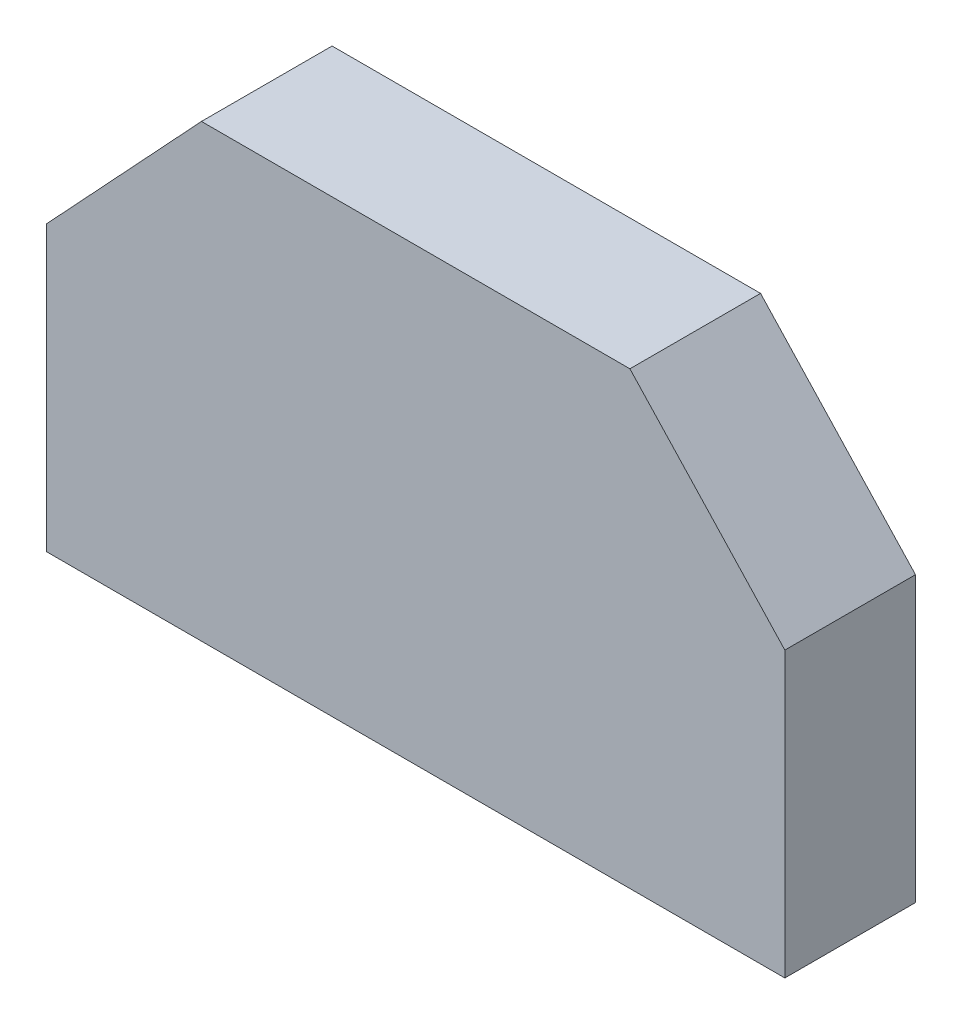
from build123d import *

# Parameters (mm, degrees)
BOSS_EXTRUDE1_DEPTH = 29.21


with BuildPart() as part:
    # Sketch1 → Boss-Extrude1 (new, symmetric)
    with BuildSketch(Plane.XY):
        Polygon((-165.1, 0), (165.1, 0), (165.1, 127), (95.808966618, 201.305536085), (-95.808966618, 201.305536085), (-165.1, 127), align=None)
    extrude(amount=BOSS_EXTRUDE1_DEPTH, both=True)


solid = part.part
